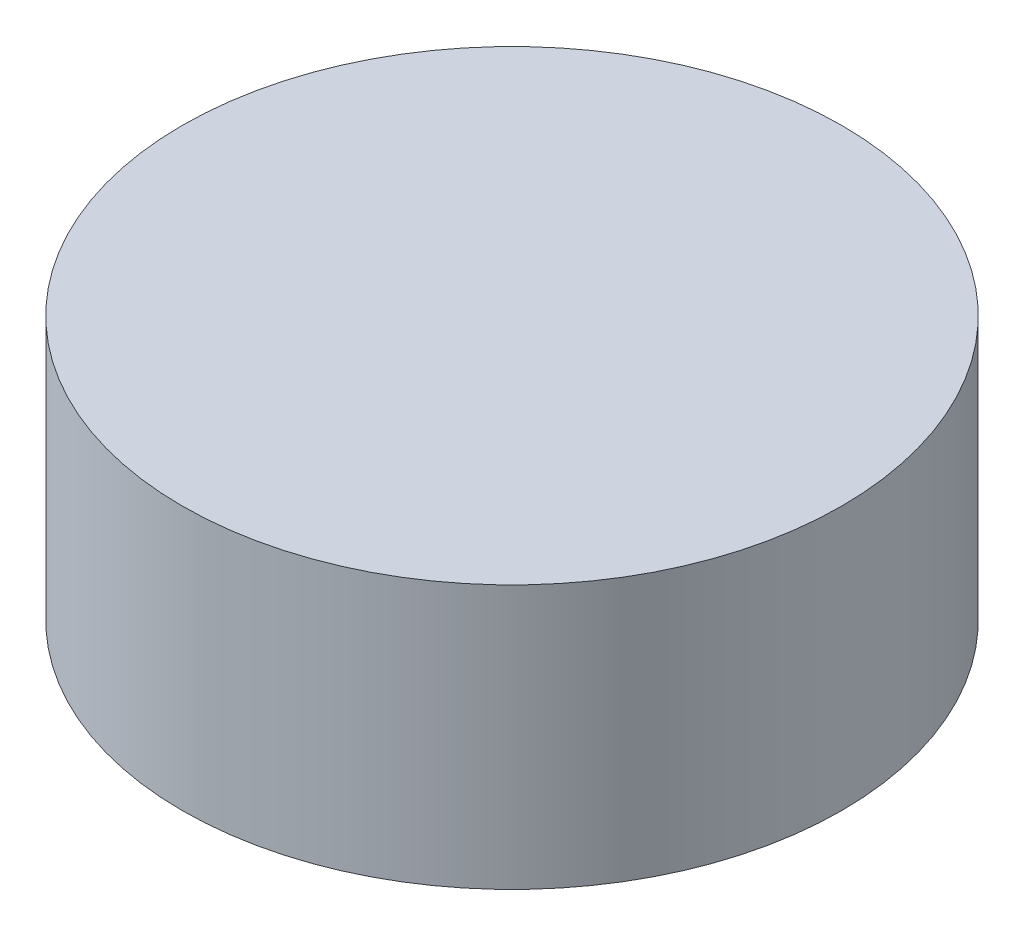
from build123d import *

# Parameters (mm, degrees)
SKETCH1_R           = 25
BOSS_EXTRUDE1_DEPTH = 20


with BuildPart() as part:
    # Sketch1 → Boss-Extrude1 (new body)
    with BuildSketch(Plane(origin=(0, 0, 0), x_dir=(1, 0, 0), z_dir=(0, 1, 0))):
        with Locations(Location((0, 0, 0), (0, 0, 270))):
            Circle(SKETCH1_R)
    extrude(amount=BOSS_EXTRUDE1_DEPTH)


solid = part.part
